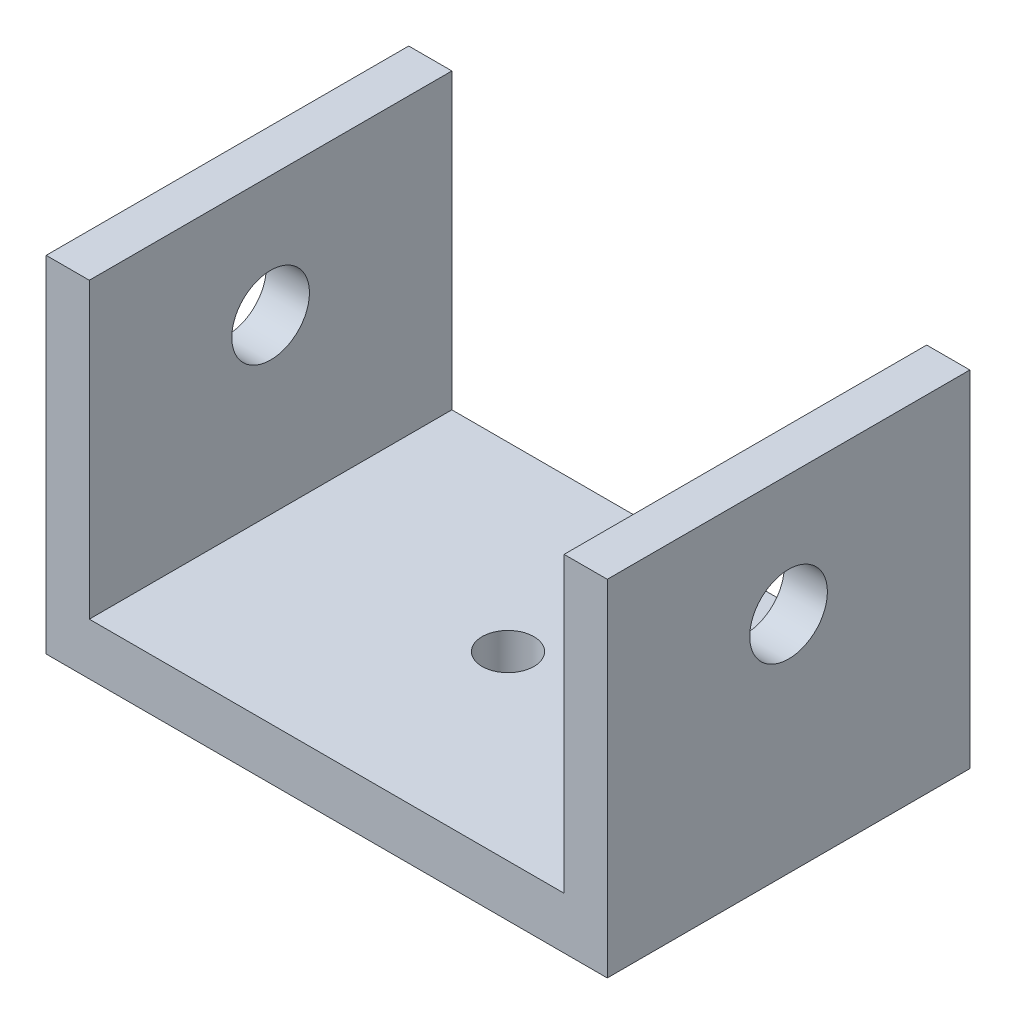
from build123d import *

# Parameters (mm, degrees)
SKETCH1_W           = 27.5
SKETCH1_H           = 21
BOSS_EXTRUDE1_DEPTH = 3
SKETCH1_4_W         = 2.5
SKETCH1_4_H         = 21
BOSS_EXTRUDE2_DEPTH = 20
SKETCH2_R           = 2.25
CUT_EXTRUDE1_DEPTH  = 40.579034854
SKETCH3_R           = 1.5
CUT_EXTRUDE2_DEPTH  = 26.754853911


with BuildPart() as part:
    # Sketch1 → Boss-Extrude1 (new body)
    with BuildSketch(Plane(origin=(0, 0, 0), x_dir=(1, 0, 0), z_dir=(0, 1, 0))):
        Rectangle(SKETCH1_W, SKETCH1_H)
    extrude(amount=BOSS_EXTRUDE1_DEPTH)

    # Sketch1<4> → Boss-Extrude2 (add)
    with BuildSketch(Plane(origin=(0, 0, 0), x_dir=(1, 0, 0), z_dir=(0, 1, 0))):
        with Locations((-15, 0)):
            Rectangle(SKETCH1_4_W, SKETCH1_4_H)
        with Locations((15, 0)):
            Rectangle(SKETCH1_4_W, SKETCH1_4_H)
    extrude(amount=BOSS_EXTRUDE2_DEPTH)

    # Sketch2 → Cut-Extrude1 (cut, through all)
    with BuildSketch(Plane(origin=(16.25, 0, 0), x_dir=(0, 0, -1), z_dir=(1, 0, 0))):
        with Locations((0, 13)):
            Circle(SKETCH2_R)
    extrude(amount=-CUT_EXTRUDE1_DEPTH, mode=Mode.SUBTRACT)

    # Sketch3 → Cut-Extrude2 (cut, through all)
    with BuildSketch(Plane(origin=(0, 3, 0), x_dir=(1, 0, 0), z_dir=(0, 1, 0))):
        Circle(SKETCH3_R)
    extrude(amount=-CUT_EXTRUDE2_DEPTH, mode=Mode.SUBTRACT)


solid = part.part
